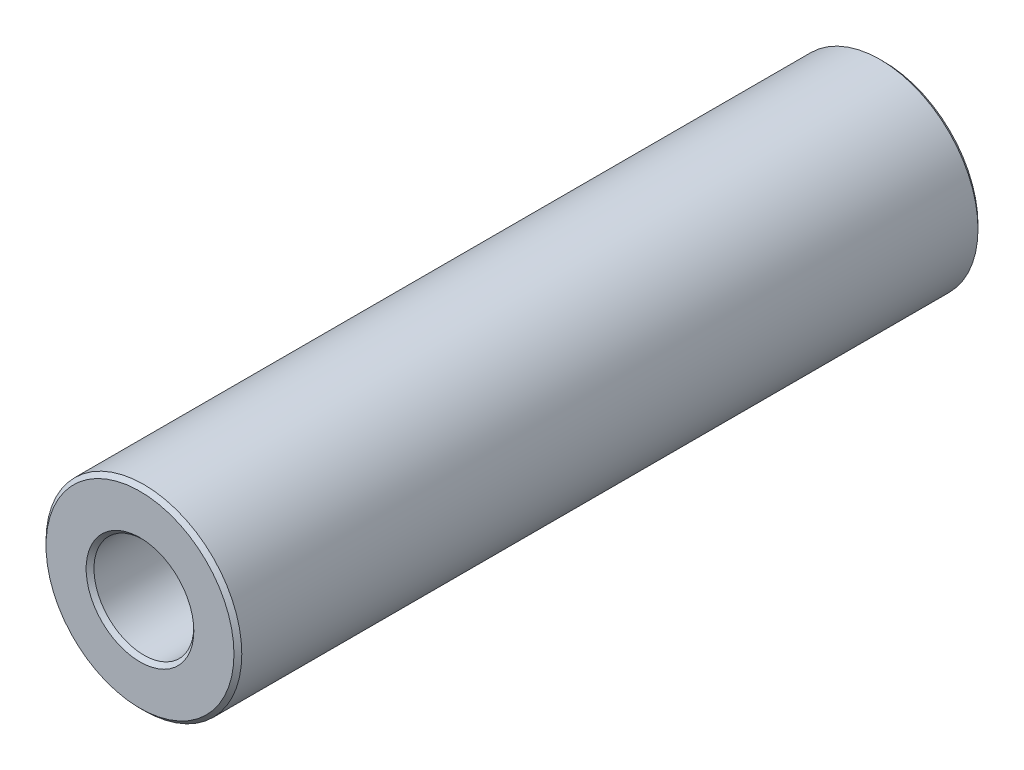
from build123d import *

# Parameters (mm, degrees)
SKETCH1_R           = 5
SKETCH1_R_2         = 2.55
BOSS_EXTRUDE1_DEPTH = 38
CHAMFER1_SIZE       = 0.2


with BuildPart() as part:
    # Sketch1 → Boss-Extrude1 (new body)
    with BuildSketch(Plane.XY):
        Circle(SKETCH1_R)
        Circle(SKETCH1_R_2, mode=Mode.SUBTRACT)
    extrude(amount=BOSS_EXTRUDE1_DEPTH)

    # Chamfer1
    chamfer1_edges = [part.edges().sort_by_distance(p)[0] for p in [
        (-5, 0, 0),
        (-5, 0, 38),
        (-2.55, 0, 0),
        (-2.55, 0, 38),
    ]]
    chamfer(chamfer1_edges, length=CHAMFER1_SIZE)


solid = part.part
